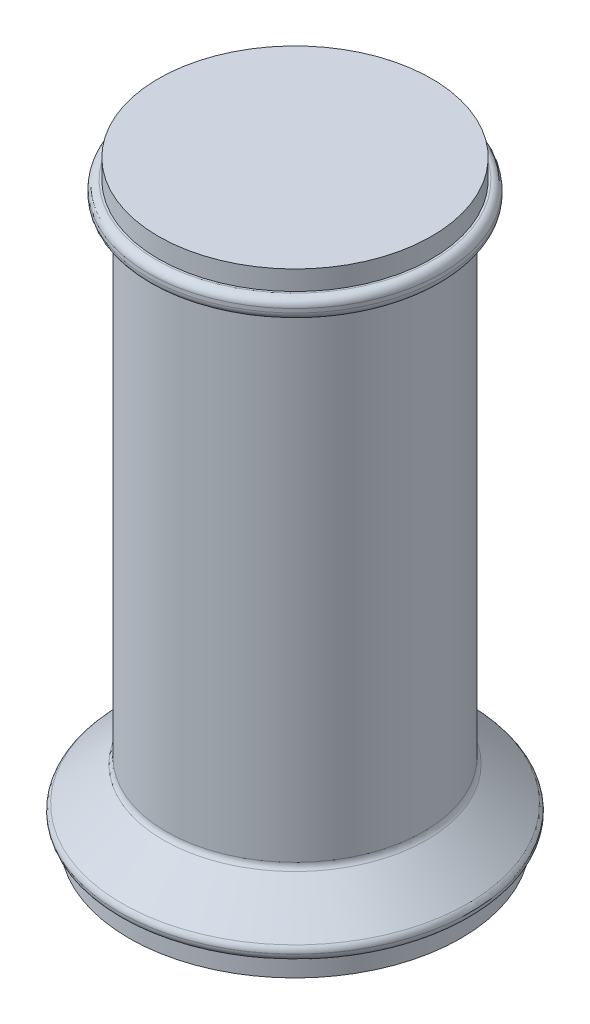
from build123d import *

# Parameters (mm, degrees)
SKETCH1_R           = 42.5
BOSS_EXTRUDE1_DEPTH = 5
SKETCH2_R           = 45
BOSS_EXTRUDE2_DEPTH = 3
SKETCH3_R           = 33
BOSS_EXTRUDE3_START = -18
SKETCH4_R           = 33
BOSS_EXTRUDE3_DEPTH = 142
SKETCH5_R           = 37.5
BOSS_EXTRUDE4_DEPTH = 5
FILLET1_R           = 2
FILLET2_R           = 2
SKETCH7_R           = 35
BOSS_EXTRUDE5_DEPTH = 5


with BuildPart() as part:
    # Sketch1 → Boss-Extrude1 (new body)
    with BuildSketch(Plane(origin=(0, 0, 0), x_dir=(1, 0, 0), z_dir=(0, 1, 0))):
        with Locations(Location((0, 0, 0), (0, 0, 270))):
            Circle(SKETCH1_R)
    extrude(amount=BOSS_EXTRUDE1_DEPTH)

    # Sketch2 → Boss-Extrude2 (add)
    with BuildSketch(Plane(origin=(0, 5, 0), x_dir=(1, 0, 0), z_dir=(0, 1, 0))):
        with Locations(Location((0, 0, 0), (0, 0, 270))):
            Circle(SKETCH2_R)
    extrude(amount=BOSS_EXTRUDE2_DEPTH)

    # Sketch3 → section 1 of loft1
    with BuildSketch(Plane(origin=(0, 18, 0), x_dir=(1, 0, 0), z_dir=(0, 1, 0)), mode=Mode.PRIVATE) as loft1_s1:
        Circle(SKETCH3_R)
    # loft from a face of the part (loft1)
    loft([part.faces().sort_by_distance((0, 8, 0))[0], loft1_s1.sketch])

    # Sketch4 → Boss-Extrude3 (add)
    with BuildSketch(Plane(origin=(0, 18, 0), x_dir=(1, 0, 0), z_dir=(0, 1, 0)).offset(BOSS_EXTRUDE3_START)):
        with Locations(Location((0, 0, 0), (0, 0, 270))):
            Circle(SKETCH4_R)
    extrude(amount=BOSS_EXTRUDE3_DEPTH)

    # Sketch5 → Boss-Extrude4 (add)
    with BuildSketch(Plane(origin=(0, 142, 0), x_dir=(1, 0, 0), z_dir=(0, 1, 0))):
        with Locations(Location((0, 0, 0), (0, 0, 270))):
            Circle(SKETCH5_R)
    extrude(amount=BOSS_EXTRUDE4_DEPTH)

    # Fillet1
    fillet1_edges = [part.edges().sort_by_distance(p)[0] for p in [
        (0, 18, -33),
        (0, 142, -33),
        (0, 5, -45),
        (0, 8, -45),
    ]]
    fillet(fillet1_edges, radius=FILLET1_R)

    # Fillet2
    fillet2_edges = [part.edges().sort_by_distance(p)[0] for p in [
        (0, 142, -37.5),
        (0, 147, -37.5),
    ]]
    fillet(fillet2_edges, radius=FILLET2_R)

    # Sketch7 → Boss-Extrude5 (add)
    with BuildSketch(Plane(origin=(0, 147, 0), x_dir=(1, 0, 0), z_dir=(0, 1, 0))):
        with Locations(Location((0, 0, 0), (0, 0, 270))):
            Circle(SKETCH7_R)
    extrude(amount=BOSS_EXTRUDE5_DEPTH)


solid = part.part
